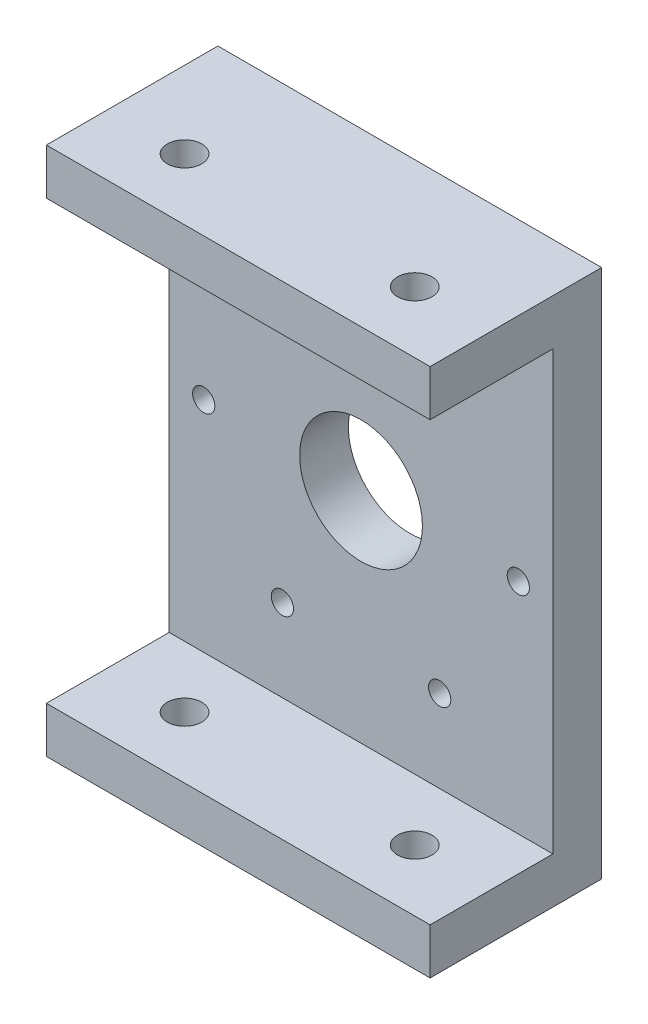
from build123d import *

# Parameters (mm, degrees)
REPISA_START                   = 519.65
SK_REPISA_W                    = 50
SK_REPISA_H                    = 69
REPISA_DEPTH                   = 6.35
CENTRO_MOTOR_START             = 519.65
SK_CENTRO_MOTOR_R              = 8
CENTRO_MOTOR_DEPTH             = 6.35
PASANTES_M2_5_ESTATOR_J6_START = 519.65
SK_PASANTES_M2_5_ESTATOR_J6_R  = 1.45
PASANTES_M2_5_ESTATOR_J6_DEPTH = 6.35
PESTANAS_START                 = 526
SK_PESTANAS_W                  = 50
SK_PESTANAS_H                  = 6
PESTANAS_DEPTH                 = 16
PASANTES_M4_PESTANAS_START     = -34.5
SK_PASANTES_M4_PESTANAS_R      = 2.25
PASANTES_M4_PESTANAS_DEPTH     = 69


with BuildPart() as part:
    # Sk_Repisa → Repisa (new body)
    with BuildSketch(Plane.XY.offset(REPISA_START)):
        Rectangle(SK_REPISA_W, SK_REPISA_H)
    extrude(amount=REPISA_DEPTH)

    # Sk_Centro_motor → Centro_motor (cut)
    with BuildSketch(Plane.XY.offset(CENTRO_MOTOR_START)):
        Circle(SK_CENTRO_MOTOR_R)
    extrude(amount=CENTRO_MOTOR_DEPTH, mode=Mode.SUBTRACT)

    # Sk_Pasantes_M2-5_estator_J6 → Pasantes_M2-5_estator_J6 (cut)
    with BuildSketch(Plane.XY.offset(PASANTES_M2_5_ESTATOR_J6_START)):
        with Locations((20.5, 0)):
            Circle(SK_PASANTES_M2_5_ESTATOR_J6_R)
        with Locations((10.25, 17.753520778)):
            Circle(SK_PASANTES_M2_5_ESTATOR_J6_R)
        with Locations((-10.25, 17.753520778)):
            Circle(SK_PASANTES_M2_5_ESTATOR_J6_R)
        with Locations((-20.5, 0)):
            Circle(SK_PASANTES_M2_5_ESTATOR_J6_R)
        with Locations((-10.25, -17.753520778)):
            Circle(SK_PASANTES_M2_5_ESTATOR_J6_R)
        with Locations((10.25, -17.753520778)):
            Circle(SK_PASANTES_M2_5_ESTATOR_J6_R)
    extrude(amount=PASANTES_M2_5_ESTATOR_J6_DEPTH, mode=Mode.SUBTRACT)

    # Sk_Pestanas → Pestanas (add)
    with BuildSketch(Plane.XY.offset(PESTANAS_START)):
        with Locations((0, 31.5)):
            Rectangle(SK_PESTANAS_W, SK_PESTANAS_H)
        with Locations((0, -31.5)):
            Rectangle(SK_PESTANAS_W, SK_PESTANAS_H)
    extrude(amount=PESTANAS_DEPTH)

    # Sk_Pasantes_M4_pestanas → Pasantes_M4_pestanas (cut)
    with BuildSketch(Plane(origin=(0, 0, 0), x_dir=(1, 0, 0), z_dir=(0, 1, 0)).offset(PASANTES_M4_PESTANAS_START)):
        with Locations(Location((-15, -534, 0), (0, 0, 270))):
            Circle(SK_PASANTES_M4_PESTANAS_R)
        with Locations(Location((15, -534, 0), (0, 0, 270))):
            Circle(SK_PASANTES_M4_PESTANAS_R)
    extrude(amount=PASANTES_M4_PESTANAS_DEPTH, mode=Mode.SUBTRACT)


solid = part.part
